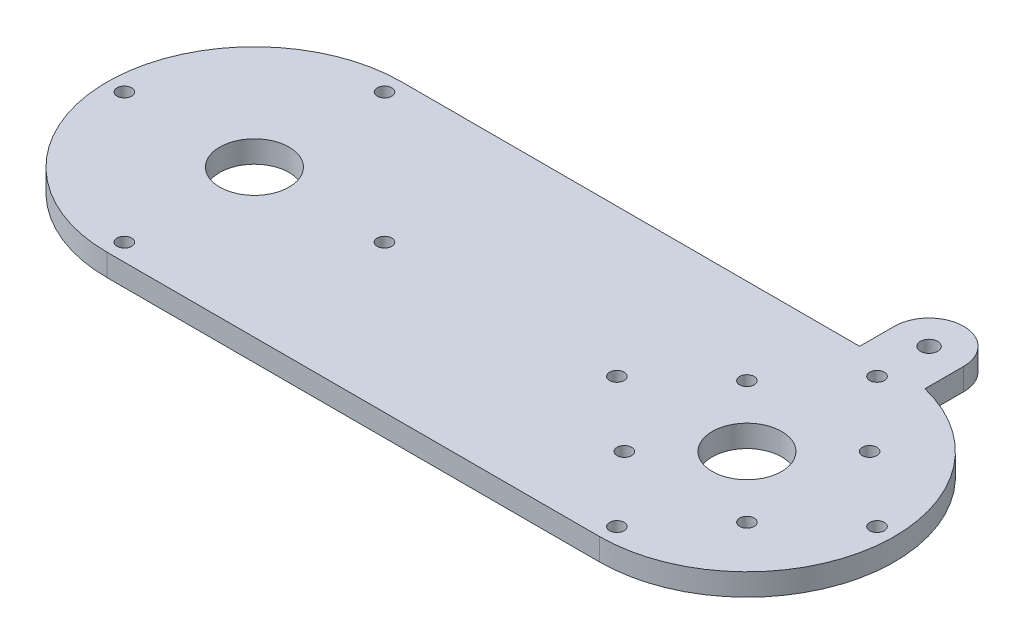
from build123d import *

# Parameters (mm, degrees)
SKETCH1_R           = 2.1
SKETCH1_R_2         = 10
SKETCH1_R_3         = 2.5
BOSS_EXTRUDE1_DEPTH = 6.35


with BuildPart() as part:
    # Sketch1 → Boss-Extrude1 (new body)
    with BuildSketch(Plane(origin=(0, 0, 0), x_dir=(1, 0, 0), z_dir=(0, 1, 0))):
        with BuildLine():
            Line((-10, 42.5), (-142, 42.5))
            ThreePointArc((-142, 42.5), (-184.5, 0), (-142, -42.5))
            Line((-142, -42.5), (0, -42.5))
            ThreePointArc((0, -42.5), (42.200640469, -5.0354686), (10, 41.306779105))
            Line((10, 41.306779105), (10, 52.5))
            ThreePointArc((10, 52.5), (0, 62.5), (-10, 52.5))
            Line((-10, 52.5), (-10, 42.5))
        make_face()
        with Locations(Location((-104.5, 0, 0), (0, 0, 270))):
            Circle(SKETCH1_R, mode=Mode.SUBTRACT)
        with Locations(Location((-142, 37.5, 0), (0, 0, 270))):
            Circle(SKETCH1_R, mode=Mode.SUBTRACT)
        with Locations(Location((-142, -37.5, 0), (0, 0, 270))):
            Circle(SKETCH1_R, mode=Mode.SUBTRACT)
        with Locations(Location((-179.5, 0, 0), (0, 0, 270))):
            Circle(SKETCH1_R, mode=Mode.SUBTRACT)
        with Locations(Location((-142, 0, 0), (0, 0, 270))):
            Circle(SKETCH1_R_2, mode=Mode.SUBTRACT)
        with Locations(Location((0, 37.5, 0), (0, 0, 270))):
            Circle(SKETCH1_R, mode=Mode.SUBTRACT)
        with Locations(Location((17.67766953, 17.67766953, 0), (0, 0, 270))):
            Circle(SKETCH1_R, mode=Mode.SUBTRACT)
        with Locations(Location((-17.67766953, -17.67766953, 0), (0, 0, 270))):
            Circle(SKETCH1_R, mode=Mode.SUBTRACT)
        with Locations(Location((0, -37.5, 0), (0, 0, 270))):
            Circle(SKETCH1_R, mode=Mode.SUBTRACT)
        with Locations(Location((17.67766953, -17.67766953, 0), (0, 0, 270))):
            Circle(SKETCH1_R, mode=Mode.SUBTRACT)
        with Locations(Location((-37.5, 0, 0), (0, 0, 270))):
            Circle(SKETCH1_R, mode=Mode.SUBTRACT)
        with Locations(Location((0, 0, 0), (0, 0, 270))):
            Circle(SKETCH1_R_2, mode=Mode.SUBTRACT)
        with Locations(Location((37.5, 0, 0), (0, 0, 270))):
            Circle(SKETCH1_R, mode=Mode.SUBTRACT)
        with Locations(Location((-17.67766953, 17.67766953, 0), (0, 0, 270))):
            Circle(SKETCH1_R, mode=Mode.SUBTRACT)
        with Locations(Location((0, 52.5, 0), (0, 0, 270))):
            Circle(SKETCH1_R_3, mode=Mode.SUBTRACT)
    extrude(amount=-BOSS_EXTRUDE1_DEPTH)


solid = part.part
